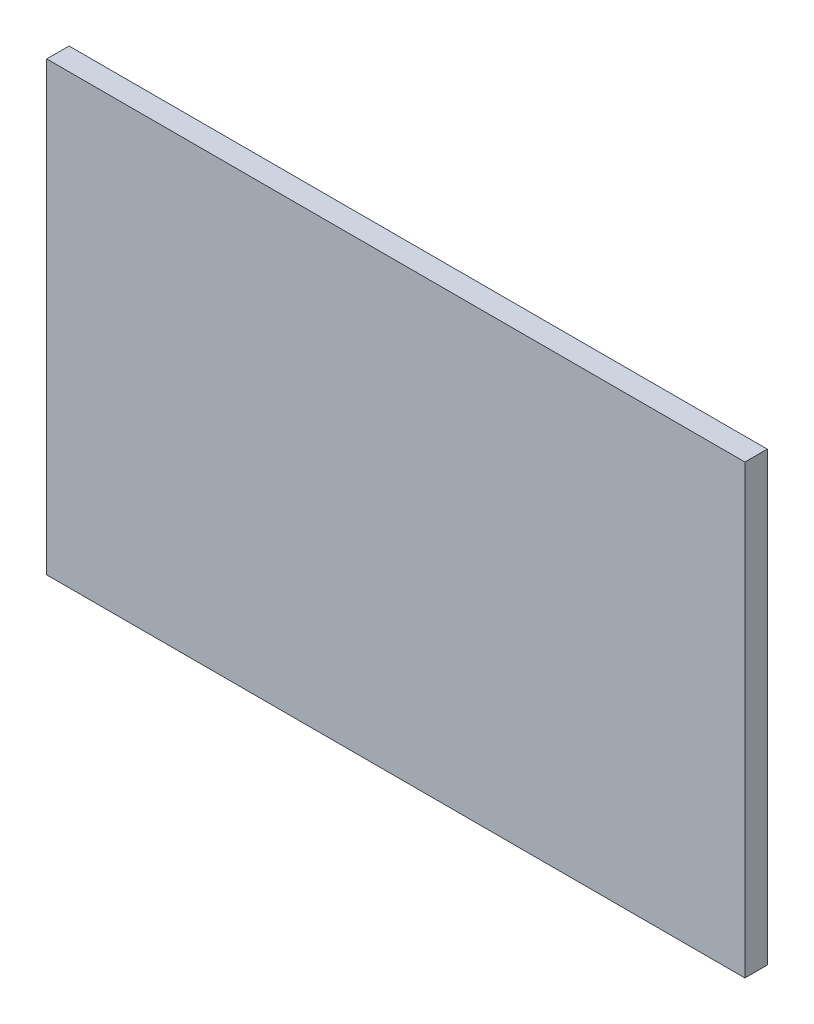
from build123d import *

# Parameters (mm, degrees)
ESQUISSE1_W        = 250
ESQUISSE1_H        = 160
BOSS_EXTRU_1_DEPTH = 8


with BuildPart() as part:
    # Esquisse1 → Boss.-Extru.1 (new body)
    with BuildSketch(Plane.XY):
        with Locations((125, 80)):
            Rectangle(ESQUISSE1_W, ESQUISSE1_H)
    extrude(amount=BOSS_EXTRU_1_DEPTH)


solid = part.part
